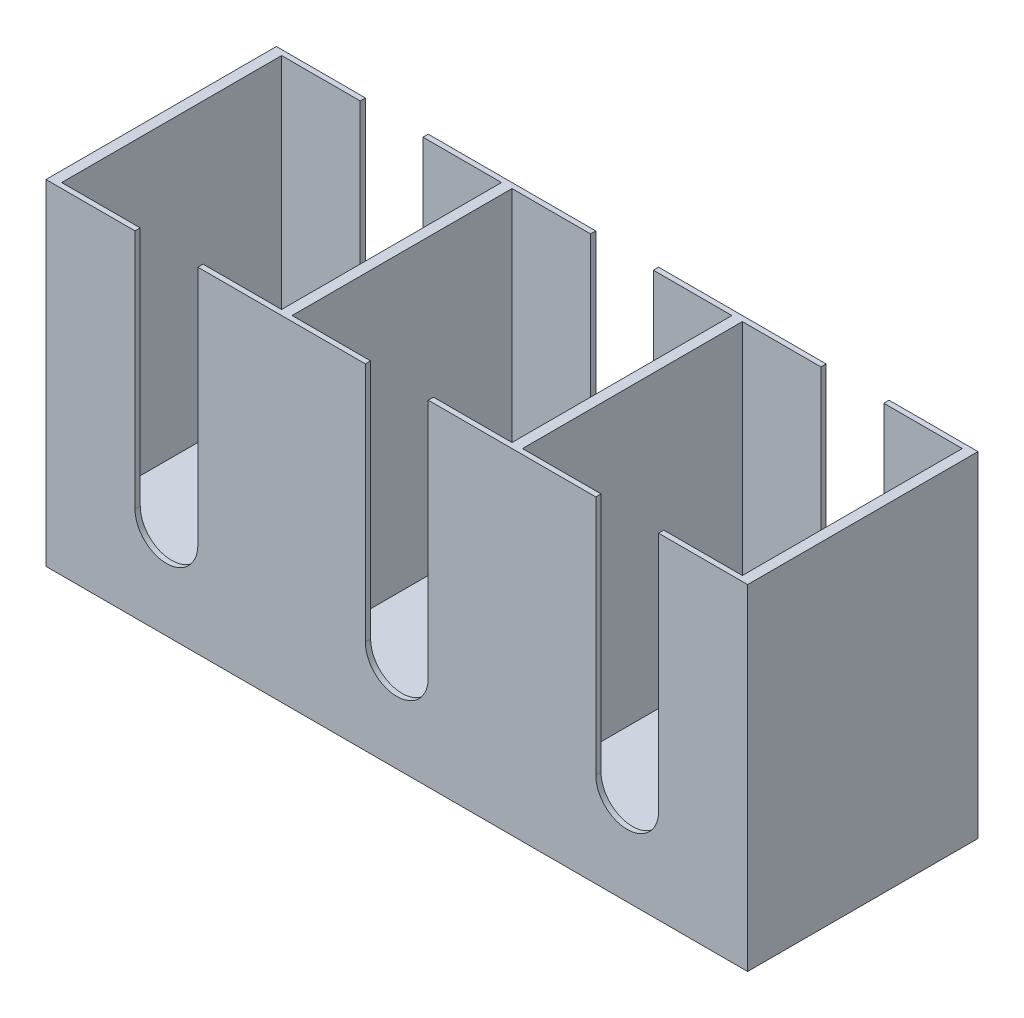
from build123d import *

# Parameters (mm, degrees)
CROQUIS1_W              = 67
CROQUIS1_H              = 22
CROQUIS1_W_2            = 21
CROQUIS1_H_2            = 21
SALIENTE_EXTRUIR1_DEPTH = 32
CROQUIS1_2_W            = 21
CROQUIS1_2_H            = 21
SALIENTE_EXTRUIR2_DEPTH = 4
CORTAR_EXTRUIR1_DEPTH   = 52.285962992


with BuildPart() as part:
    # Croquis1 → Saliente-Extruir1 (new body)
    with BuildSketch(Plane(origin=(0, 0, 0), x_dir=(1, 0, 0), z_dir=(0, 1, 0))):
        Rectangle(CROQUIS1_W, CROQUIS1_H)
        Rectangle(CROQUIS1_W_2, CROQUIS1_H_2, mode=Mode.SUBTRACT)
        with Locations((-22, 0)):
            Rectangle(CROQUIS1_W_2, CROQUIS1_H_2, mode=Mode.SUBTRACT)
        with Locations((22, 0)):
            Rectangle(CROQUIS1_W_2, CROQUIS1_H_2, mode=Mode.SUBTRACT)
    extrude(amount=SALIENTE_EXTRUIR1_DEPTH)

    # Croquis1<2> → Saliente-Extruir2 (add)
    with BuildSketch(Plane(origin=(0, 0, 0), x_dir=(1, 0, 0), z_dir=(0, 1, 0))):
        Rectangle(CROQUIS1_2_W, CROQUIS1_2_H)
        with Locations((-22, 0)):
            Rectangle(CROQUIS1_2_W, CROQUIS1_2_H)
        with Locations((22, 0)):
            Rectangle(CROQUIS1_2_W, CROQUIS1_2_H)
    extrude(amount=SALIENTE_EXTRUIR2_DEPTH)

    # Croquis2 → Cortar-Extruir1 (cut, through all)
    with BuildSketch(Plane.XY.offset(11)):
        with BuildLine():
            Line((-25, 32), (-25, 9))
            ThreePointArc((-25, 9), (-22, 6), (-19, 9))
            Line((-19, 9), (-19, 32))
            Line((-19, 32), (-25, 32))
        make_face()
        with BuildLine():
            Line((-3, 32), (-3, 9))
            ThreePointArc((-3, 9), (0, 6), (3, 9))
            Line((3, 9), (3, 32))
            Line((3, 32), (-3, 32))
        make_face()
        with BuildLine():
            Line((19, 32), (19, 9))
            ThreePointArc((19, 9), (22, 6), (25, 9))
            Line((25, 9), (25, 32))
            Line((25, 32), (19, 32))
        make_face()
    extrude(amount=-CORTAR_EXTRUIR1_DEPTH, mode=Mode.SUBTRACT)


solid = part.part
